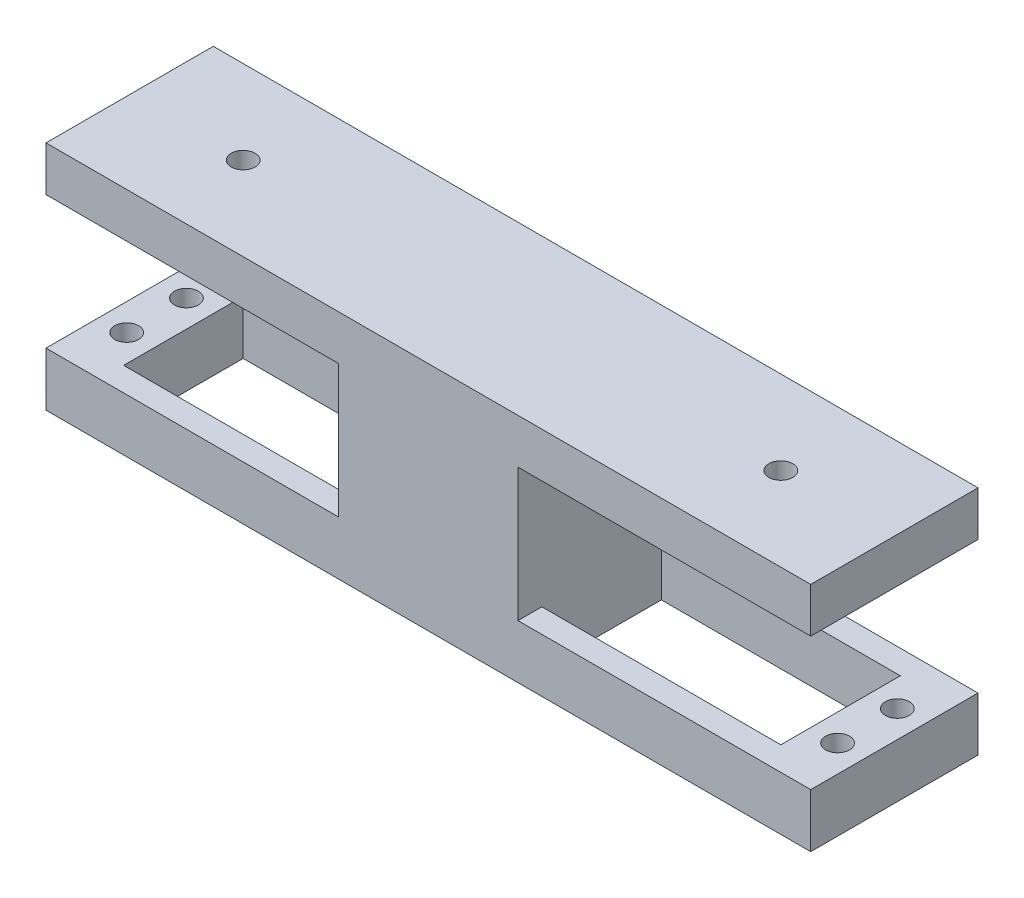
from build123d import *

# Parameters (mm, degrees)
SKETCH1_W               = 160
SKETCH1_H               = 45
BOSS_EXTRUDE1_DEPTH     = 28
SKETCH3_W               = 65
SKETCH3_H               = 25
CUT_EXTRUDE2_DEPTH      = 28
CUT_EXTRUDE3_DEPTH      = 28
SKETCH8_R               = 2
CUT_EXTRUDE4_DEPTH      = 10
CUT_EXTRUDE5_DEPTH      = 169.549695936
CUT_EXTRUDE5_DEPTH_BACK = 169.549695936
SKETCH9_W               = 16
SKETCH9_H               = 28
SKETCH10_W              = 128
SKETCH10_H              = 5.5
CUT_EXTRUDE6_DEPTH      = 154.443800787
SKETCH11_W              = 128
SKETCH11_H              = 2.75
CUT_EXTRUDE7_DEPTH      = 152.921854912
SKETCH12_W              = 128
SKETCH12_H              = 2.75
BOSS_EXTRUDE3_DEPTH     = 28
SKETCH13_R              = 2
CUT_EXTRUDE8_DEPTH      = 152.230163989
SKETCH14_W              = 128
SKETCH14_H              = 28
BOSS_EXTRUDE4_DEPTH     = 2
SKETCH16_R              = 2
CUT_EXTRUDE9_DEPTH      = 152.230163989


with BuildPart() as part:
    # Sketch1 → Boss-Extrude1 (new body)
    with BuildSketch(Plane.XY):
        with Locations((80, 22.5)):
            Rectangle(SKETCH1_W, SKETCH1_H)
    extrude(amount=BOSS_EXTRUDE1_DEPTH)

    # Sketch3 → Cut-Extrude2 (cut)
    with BuildSketch(Plane.XY.offset(28)):
        with Locations((32.5, 21.5)):
            Rectangle(SKETCH3_W, SKETCH3_H)
        with Locations((127.5, 21.5)):
            Rectangle(SKETCH3_W, SKETCH3_H)
    extrude(amount=-CUT_EXTRUDE2_DEPTH, mode=Mode.SUBTRACT)

    # Sketch6 → Cut-Extrude3 (cut)
    with BuildSketch(Plane.XZ):
        Polygon((65, 14), (65, 24), (25, 24), (25, 4), (65, 4), align=None)
        Polygon((95, 4), (95, 14), (95, 24), (135, 24), (135, 4), align=None)
    extrude(amount=-CUT_EXTRUDE3_DEPTH, mode=Mode.SUBTRACT)

    # Sketch8 → Cut-Extrude4 (cut)
    with BuildSketch(Plane(origin=(0, 0, 0), x_dir=(-1, 0, 0), z_dir=(0, -1, 0))):
        with Locations(Location((-20.5, -9, 0), (0, 0, 90))):
            Circle(SKETCH8_R)
        with Locations(Location((-20.5, -19, 0), (0, 0, 90))):
            Circle(SKETCH8_R)
        with Locations(Location((-90.5, -19, 0), (0, 0, 90))):
            Circle(SKETCH8_R)
        with Locations(Location((-90.5, -9, 0), (0, 0, 90))):
            Circle(SKETCH8_R)
        with Locations(Location((-139.5, -19, 0), (0, 0, 90))):
            Circle(SKETCH8_R)
        with Locations(Location((-139.5, -9, 0), (0, 0, 90))):
            Circle(SKETCH8_R)
        with Locations(Location((-69.5, -19, 0), (0, 0, 90))):
            Circle(SKETCH8_R)
        with Locations(Location((-69.5, -9, 0), (0, 0, 90))):
            Circle(SKETCH8_R)
    extrude(amount=-CUT_EXTRUDE4_DEPTH, mode=Mode.SUBTRACT)

    # Sketch9 → Cut-Extrude5 (cut, two sides: drawn at the far end of the back side and taken through both)
    with BuildSketch(Plane(origin=(0, 0, 0), x_dir=(-1, 0, 0), z_dir=(0, -1, 0)).offset(-CUT_EXTRUDE5_DEPTH_BACK)):
        with Locations((-152, -14)):
            Rectangle(SKETCH9_W, SKETCH9_H)
        with Locations((-8, -14)):
            Rectangle(SKETCH9_W, SKETCH9_H)
    extrude(amount=CUT_EXTRUDE5_DEPTH + CUT_EXTRUDE5_DEPTH_BACK, mode=Mode.SUBTRACT)

    # Sketch10 → Cut-Extrude6 (cut, through all)
    with BuildSketch(Plane.XY.offset(28)):
        with Locations((80, 42.25)):
            Rectangle(SKETCH10_W, SKETCH10_H)
    extrude(amount=-CUT_EXTRUDE6_DEPTH, mode=Mode.SUBTRACT)

    # Sketch11 → Cut-Extrude7 (cut, through all)
    with BuildSketch(Plane.XY.offset(28)):
        with Locations((80, 38.125)):
            Rectangle(SKETCH11_W, SKETCH11_H)
    extrude(amount=-CUT_EXTRUDE7_DEPTH, mode=Mode.SUBTRACT)

    # Sketch12 → Boss-Extrude3 (add)
    with BuildSketch(Plane.XY.offset(28)):
        with Locations((80, 32.625)):
            Rectangle(SKETCH12_W, SKETCH12_H)
    extrude(amount=-BOSS_EXTRUDE3_DEPTH)

    # Sketch13 → Cut-Extrude8 (cut, through all)
    with BuildSketch(Plane(origin=(0, 36.75, 0), x_dir=(1, 0, 0), z_dir=(0, 1, 0))):
        with Locations(Location((125, -14, 0), (0, 0, 270))):
            Circle(SKETCH13_R)
        with Locations(Location((35, -14, 0), (0, 0, 270))):
            Circle(SKETCH13_R)
    extrude(amount=-CUT_EXTRUDE8_DEPTH, mode=Mode.SUBTRACT)

    # Sketch14 → Boss-Extrude4 (add)
    with BuildSketch(Plane(origin=(0, 36.75, 0), x_dir=(1, 0, 0), z_dir=(0, 1, 0))):
        with Locations((80, -14)):
            Rectangle(SKETCH14_W, SKETCH14_H)
    extrude(amount=BOSS_EXTRUDE4_DEPTH)

    # Sketch16 → Cut-Extrude9 (cut, through all)
    with BuildSketch(Plane.XZ.offset(-36.75)):
        with Locations(Location((125, 14, 0), (0, 0, 90))):
            Circle(SKETCH16_R)
        with Locations(Location((35, 14, 0), (0, 0, 90))):
            Circle(SKETCH16_R)
    extrude(amount=-CUT_EXTRUDE9_DEPTH, mode=Mode.SUBTRACT)


solid = part.part
